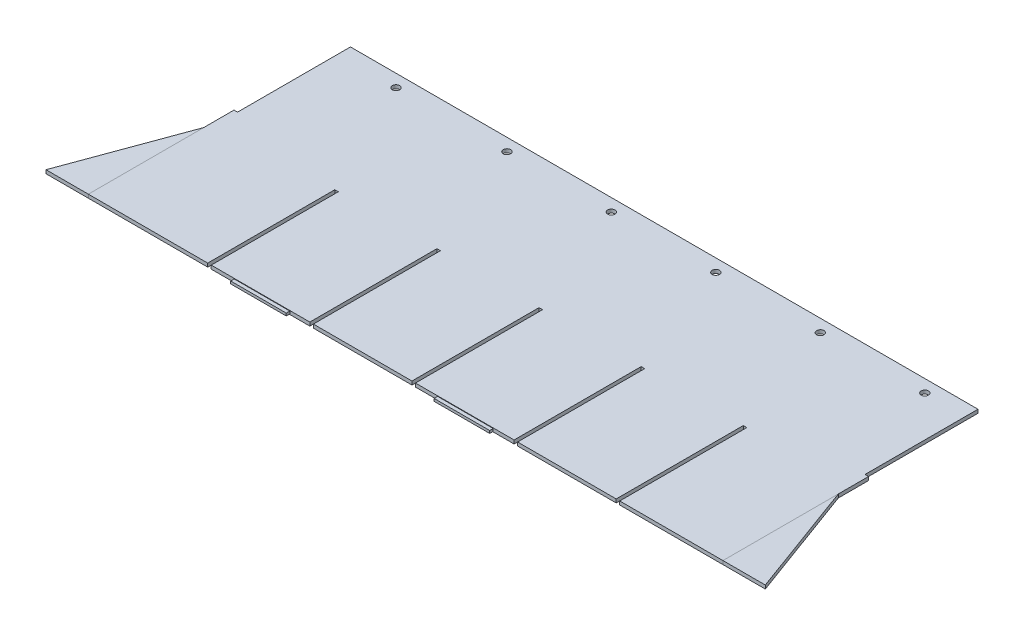
from build123d import *

# Parameters (mm, degrees)
SKETCH1_W               = 570.861
SKETCH1_H               = 3.175
BOSS_EXTRUDE1_DEPTH     = 232.6
SKETCH2_W               = 3.175
SKETCH2_H               = 114.3
CUT_EXTRUDE1_DEPTH      = 3.175
SKETCH7_R               = 3.302
CUT_EXTRUDE4_DEPTH      = 369.216527271
SKETCH6_W               = 50
SKETCH6_H               = 2.286
BOSS_EXTRUDE2_DEPTH     = 3.175
LPATTERN1_COUNT         = 5
LPATTERN1_PITCH         = 93.98
BOSS_EXTRUDE4_DEPTH     = 3.175
BOSS_EXTRUDE4_2_DEPTH   = 3.175
LPATTERN2_COUNT         = 5
LPATTERN2_PITCH         = 91.86599991
SKETCH2_4_W             = 3.175
SKETCH2_4_H             = 101.6
CUT_EXTRUDE5_DEPTH      = 401.339750312
CUT_EXTRUDE8_DEPTH      = 401.339750312
CUT_EXTRUDE8_DEPTH_BACK = 401.339750312
SKETCH11_R              = 3.302


with BuildPart() as part:
    # Sketch1 → Boss-Extrude1 (new body)
    with BuildSketch(Plane.XY):
        Rectangle(SKETCH1_W, SKETCH1_H)
    extrude(amount=BOSS_EXTRUDE1_DEPTH)

    # Sketch2 → Cut-Extrude1 (cut)
    with BuildSketch(Plane(origin=(0, 1.5875, 0), x_dir=(1, 0, 0), z_dir=(0, 1, 0))):
        with Locations((-176.4739996, -175.45)):
            Rectangle(SKETCH2_W, SKETCH2_H)
    cut_extrude1 = extrude(amount=-CUT_EXTRUDE1_DEPTH, mode=Mode.SUBTRACT)

    # Sketch7 → Cut-Extrude4 (cut, through all)
    with BuildSketch(Plane(origin=(0, -1.5875, 0), x_dir=(-1, 0, 0), z_dir=(0, -1, 0))):
        with Locations((-245.6805, -11.29165)):
            Circle(SKETCH7_R)
    cut_extrude4 = extrude(amount=-CUT_EXTRUDE4_DEPTH, mode=Mode.SUBTRACT)

    # Sketch6 → Boss-Extrude2 (add)
    with BuildSketch(Plane.XY.offset(232.6)):
        with Locations((53.761993, 0)):
            Rectangle(SKETCH6_W, SKETCH6_H)
        with Locations((-129.238007, 0)):
            Rectangle(SKETCH6_W, SKETCH6_H)
    extrude(amount=BOSS_EXTRUDE2_DEPTH)

    # LPattern1: Cut-Extrude4 ×5
    with Locations(*[(-i * LPATTERN1_PITCH, 0, 0) for i in range(1, LPATTERN1_COUNT)]):
        add(cut_extrude4, mode=Mode.SUBTRACT)

    # LPattern2: Cut-Extrude1 ×5
    with Locations(*[(i * LPATTERN2_PITCH, 0, 0) for i in range(1, LPATTERN2_COUNT)]):
        add(cut_extrude1, mode=Mode.SUBTRACT)

    # Sketch2<4> → Cut-Extrude5 (cut, through all)
    with BuildSketch(Plane(origin=(0, 1.5875, 0), x_dir=(1, 0, 0), z_dir=(0, 1, 0))):
        with Locations((283.843, -50.8)):
            Rectangle(SKETCH2_4_W, SKETCH2_4_H)
        with Locations((-283.843, -50.8)):
            Rectangle(SKETCH2_4_W, SKETCH2_4_H)
    extrude(amount=-CUT_EXTRUDE5_DEPTH, mode=Mode.SUBTRACT)

    # Sketch11 → Cut-Extrude8 (cut, two sides: drawn at the far end of the back side and taken through both)
    with BuildSketch(Plane.XZ.offset(1.5875).offset(-CUT_EXTRUDE8_DEPTH_BACK)):
        with Locations((-230.0055, 11.29165)):
            Circle(SKETCH11_R)
    extrude(amount=CUT_EXTRUDE8_DEPTH + CUT_EXTRUDE8_DEPTH_BACK, mode=Mode.SUBTRACT)


with BuildPart() as body_2:
    # Sketch2<3> → Boss-Extrude4 (new body)
    with BuildSketch(Plane(origin=(0, 1.5875, 0), x_dir=(1, 0, 0), z_dir=(0, 1, 0))):
        Polygon((-323.5305, -232.6), (-285.4305, -232.6), (-285.4305, -128.857841698), align=None)
    extrude(amount=-BOSS_EXTRUDE4_DEPTH)


with BuildPart() as body_3:
    # Sketch2<3> → Boss-Extrude4 2 (new body)
    with BuildSketch(Plane(origin=(0, 1.5875, 0), x_dir=(1, 0, 0), z_dir=(0, 1, 0))):
        Polygon((285.4305, -128.857841698), (285.4305, -232.6), (323.5305, -232.6), align=None)
    extrude(amount=-BOSS_EXTRUDE4_2_DEPTH)


solid = Compound([part.part, body_2.part, body_3.part])
